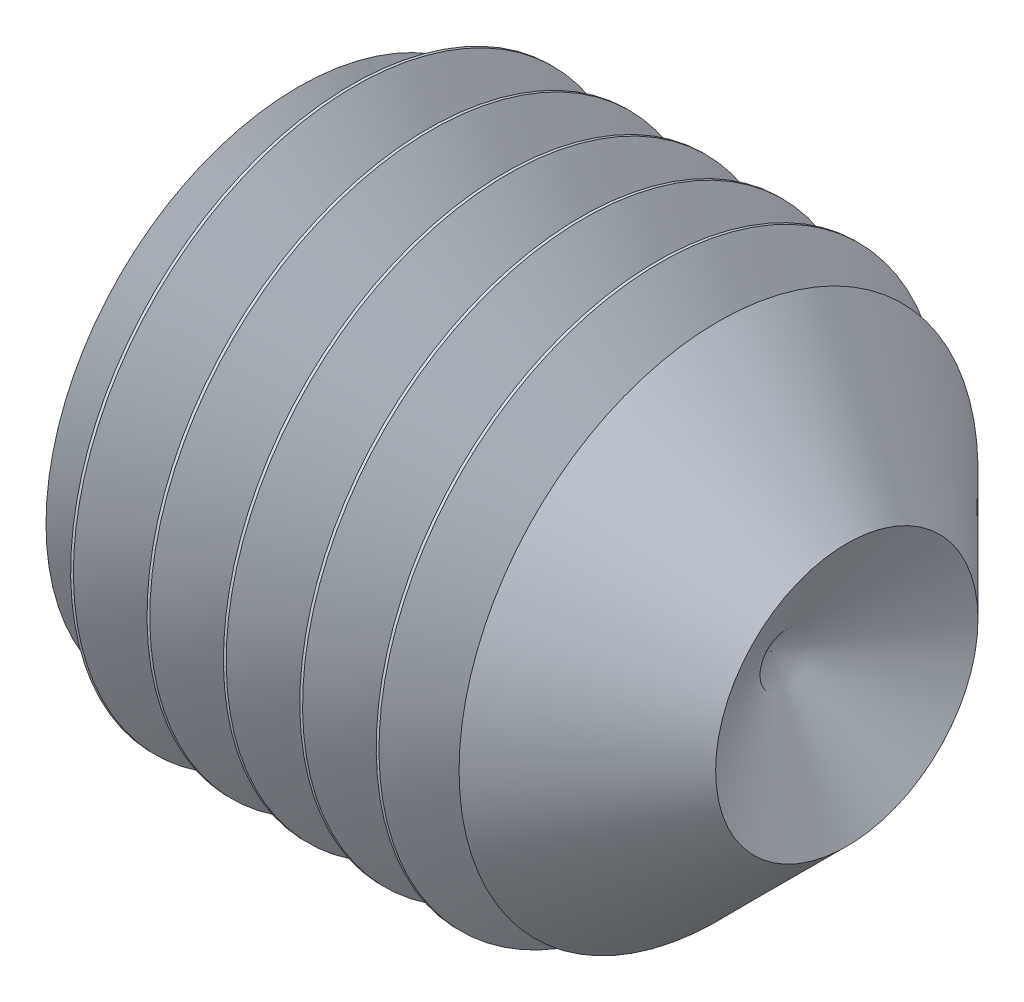
from build123d import *

# Parameters (mm, degrees)
HEX_2_DEPTH     = 2
THDSCHPAT_COUNT = 6
THDSCHPAT_PITCH = 0.407610675


with BuildPart() as part:
    # BodySke → BaseBody (revolve)
    with BuildSketch(Plane.XY, mode=Mode.PRIVATE) as basebody_sk:
        Polygon((0, 0), (0, 1.2195), (0.161946751, 1.5), (2.2, 1.5), (3, 0.7), (2.595854812, 0), align=None)
    revolve(basebody_sk.sketch.rotate(Axis((-12.7, 0, 0), (1, 0, 0)), 90), axis=Axis((-12.7, 0, 0), (1, 0, 0)))

    # Sketch2 → Hex 2 (cut)
    with BuildSketch(Plane.ZY):
        Polygon((0.433012702, 0.75), (-0.433012702, 0.75), (-0.866025404, 0), (-0.433012702, -0.75), (0.433012702, -0.75), (0.866025404, 0), align=None)
    extrude(amount=-HEX_2_DEPTH, mode=Mode.SUBTRACT)

    # ThdSchSke → ThreadSchematic (revolve, cut)
    with BuildSketch(Plane.XY):
        Polygon((0.161946751, -1.2195), (-0.034461464, -1.5), (-0.034461464, -1.875), (0.358354965, -1.875), (0.358354965, -1.5), align=None)
    threadschematic = revolve(axis=Axis((-3.175, 0, 0), (1, 0, 0)), mode=Mode.SUBTRACT)

    # ThdSchPat: ThreadSchematic ×6
    with Locations(*[(i * THDSCHPAT_PITCH, 0, 0) for i in range(1, THDSCHPAT_COUNT)]):
        add(threadschematic, mode=Mode.SUBTRACT)


solid = part.part
